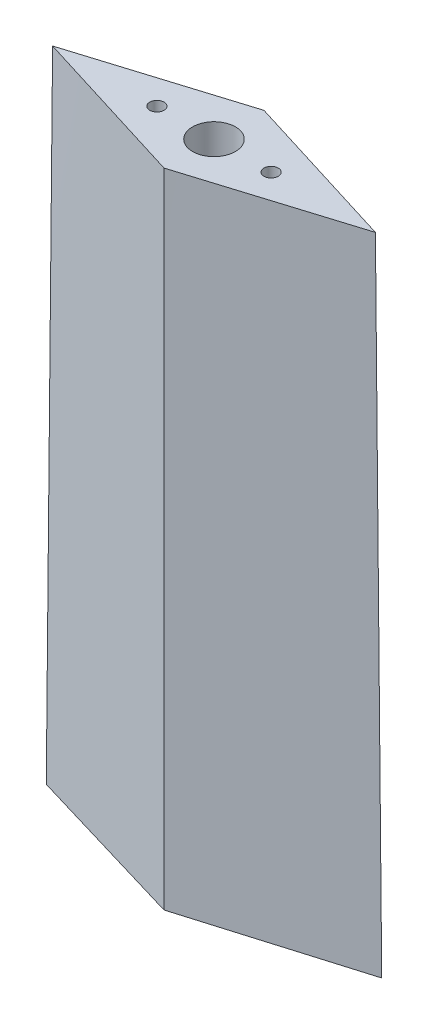
from build123d import *

# Parameters (mm, degrees)
BOSS_EXTRUDE1_DEPTH      = 11.1125
BOSS_EXTRUDE1_DEPTH_BACK = 11.1125
SKETCH5_W                = 109.877468776
SKETCH5_H                = 283.051122129
CUT_EXTRUDE2_DEPTH       = 1193.492852366
SKETCH6_W                = 149.121482991
SKETCH6_H                = 108.921761737
CUT_EXTRUDE3_DEPTH       = 1175.662940665
SKETCH7_R                = 4.7625
CUT_EXTRUDE4_DEPTH       = 635
CUT_EXTRUDE8_DEPTH       = 1195.766301895
CUT_EXTRUDE8_DEPTH_BACK  = 1195.766301895
SKETCH8_W                = 149.774750394
SKETCH8_H                = 148.832770831
SKETCH8_H_2              = 142.875
SKETCH8_H_3              = 176.125878949
SKETCH11_R               = 1.5875
CUT_EXTRUDE9_DEPTH       = 12.7
CUT_EXTRUDE10_START      = -12.7
SKETCH12_R               = 1.5875
CUT_EXTRUDE10_DEPTH      = 12.7


with BuildPart() as part:
    # Sketch1 → Boss-Extrude1 (new, two sides: drawn at the far end of the back side and taken through both)
    with BuildSketch(Plane.XY.offset(-BOSS_EXTRUDE1_DEPTH_BACK)):
        Polygon((142.42123069, 465.168027231), (219.716026672, 465.168027231), (213.502471629, 1096.967634552), (181.068628681, 1174.337215652), (148.634785732, 1096.967634552), align=None)
    extrude(amount=BOSS_EXTRUDE1_DEPTH + BOSS_EXTRUDE1_DEPTH_BACK)

    # Sketch2 → Cut-Loft1 section 0
    with BuildSketch(Plane.XZ.offset(-465.168027231)):
        with BuildLine():
            Line((142.42123069, 0), (181.068628681, 11.1125))
            Line((181.068628681, 11.1125), (219.716026672, 0))
            Line((219.716026672, 0), (222.70513775, 0))
            Line((222.70513775, 0), (222.70513775, 15.258366339))
            Line((222.70513775, 15.258366339), (137.848628215, 15.258366339))
            Line((137.848628215, 15.258366339), (137.848628215, 0))
            Line((137.848628215, 0), (142.42123069, 0))
        make_face()
    # Sketch3 → Cut-Loft1 section 1
    with BuildSketch(Plane(origin=(0, 1096.967634552, 0), x_dir=(1, 0, 0), z_dir=(0, 1, 0))):
        with BuildLine():
            Line((213.502471629, 0), (181.068628681, -11.1125))
            Line((181.068628681, -11.1125), (148.634785732, 0))
            Line((148.634785732, 0), (137.848628215, 0))
            Line((137.848628215, 0), (137.848628215, -15.258366339))
            Line((137.848628215, -15.258366339), (222.70513775, -15.258366339))
            Line((222.70513775, -15.258366339), (222.70513775, 0))
            Line((222.70513775, 0), (213.502471629, 0))
        make_face()
    cut_loft1 = loft(mode=Mode.SUBTRACT)

    # Mirror1: Cut-Loft1 across plane
    add(cut_loft1.mirror(Plane.XY), mode=Mode.SUBTRACT)

    # Sketch5 → Cut-Extrude2 (cut, through all)
    with BuildSketch(Plane(origin=(-32.103098407, 13.457832356, 93.698704331), x_dir=(0.9470206004067627, 0.045661094409327196, 0.31791043842968925), z_dir=(-0.3211728232668741, 0.1346377834927197, 0.937401026696127))):
        with Locations((219.349244299, 1139.303724701)):
            Rectangle(SKETCH5_W, SKETCH5_H)
    cut_extrude2 = extrude(amount=CUT_EXTRUDE2_DEPTH, mode=Mode.SUBTRACT)

    # Sketch6 → Cut-Extrude3 (cut, through all)
    with BuildSketch(Plane(origin=(69.458274406, 29.117370568, 202.726547902), x_dir=(0.9470206004067623, -0.045661094409327495, -0.31791043842969063), z_dir=(0.3211728232668754, 0.13463778349272, 0.9374010266961263))):
        with Locations((131.752816965, 1118.922251835)):
            Rectangle(SKETCH6_W, SKETCH6_H)
    cut_extrude3 = extrude(amount=CUT_EXTRUDE3_DEPTH, mode=Mode.SUBTRACT)

    # Mirror2: Cut-Extrude2, Cut-Extrude3 across plane
    add(cut_extrude2.mirror(Plane.XY), mode=Mode.SUBTRACT)
    add(cut_extrude3.mirror(Plane.XY), mode=Mode.SUBTRACT)

    # Sketch7 → Cut-Extrude4 (cut)
    with BuildSketch(Plane.XZ.offset(-465.168027231)):
        with Locations(Location((181.068628681, 0, 0), (0, 0, 270))):
            Circle(SKETCH7_R)
    extrude(amount=-CUT_EXTRUDE4_DEPTH, mode=Mode.SUBTRACT)

    # Sketch8 → Cut-Extrude8 (cut, two sides: drawn at the far end of the back side and taken through both)
    with BuildSketch(Plane.XY.offset(-CUT_EXTRUDE8_DEPTH_BACK)):
        with Locations((180.5976389, 528.420830237)):
            Rectangle(SKETCH8_W, SKETCH8_H)
        with Locations((180.5976389, 817.149715652)):
            Rectangle(SKETCH8_W, SKETCH8_H_2)
        with Locations((180.5976389, 960.024715652)):
            Rectangle(SKETCH8_W, SKETCH8_H_2)
        with Locations((180.5976389, 1119.525155127)):
            Rectangle(SKETCH8_W, SKETCH8_H_3)
    extrude(amount=CUT_EXTRUDE8_DEPTH + CUT_EXTRUDE8_DEPTH_BACK, mode=Mode.SUBTRACT)

    # Sketch11 → Cut-Extrude9 (cut)
    with BuildSketch(Plane(origin=(0, 745.712215652, 0), x_dir=(1, 0, 0), z_dir=(0, 1, 0))):
        with Locations(Location((168.368628681, 0, 0), (0, 0, 270))):
            Circle(SKETCH11_R)
        with Locations(Location((193.768628681, 0, 0), (0, 0, 270))):
            Circle(SKETCH11_R)
    extrude(amount=-CUT_EXTRUDE9_DEPTH, mode=Mode.SUBTRACT)

    # Sketch12 → Cut-Extrude10 (cut)
    with BuildSketch(Plane.XZ.offset(-602.837215652).offset(CUT_EXTRUDE10_START)):
        with Locations(Location((168.368628681, 0, 0), (0, 0, 90))):
            Circle(SKETCH12_R)
        with Locations(Location((193.768628681, 0, 0), (0, 0, 90))):
            Circle(SKETCH12_R)
    extrude(amount=CUT_EXTRUDE10_DEPTH, mode=Mode.SUBTRACT)


solid = part.part
